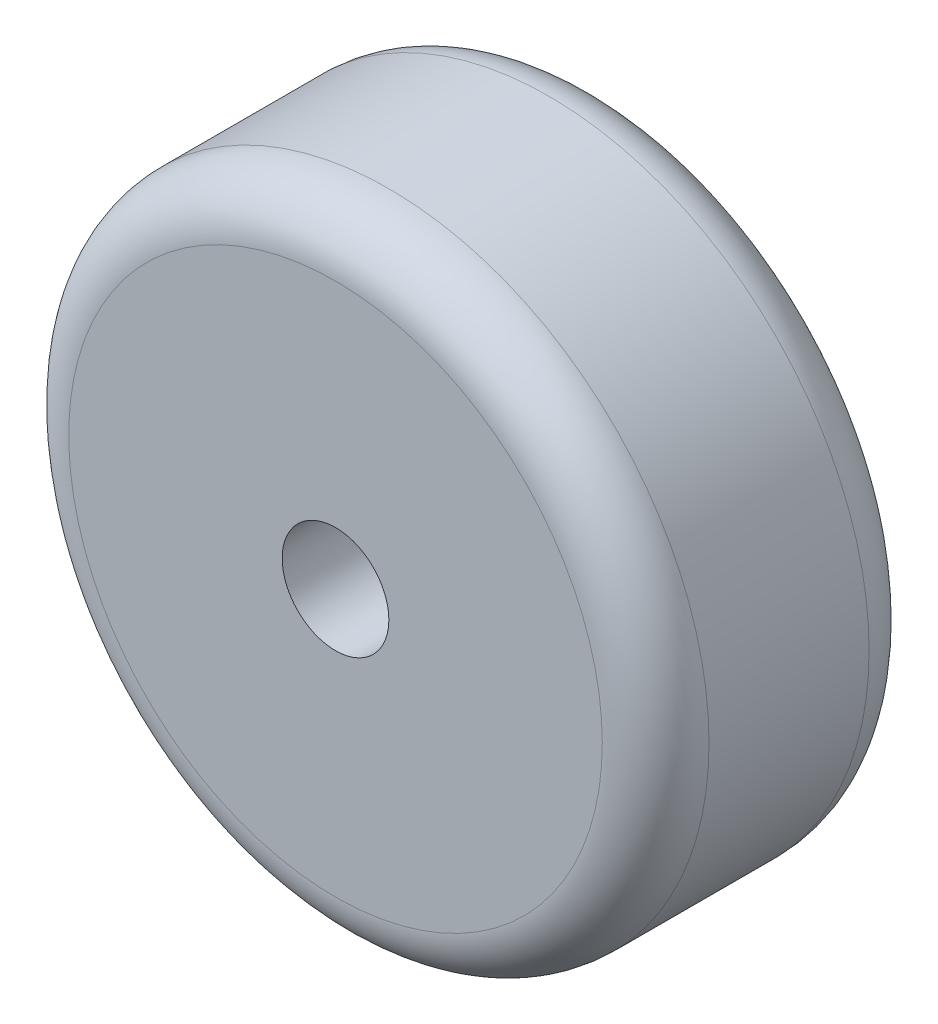
from build123d import *

# Parameters (mm, degrees)
SKETCH1_R           = 6
SKETCH1_R_2         = 1
BOSS_EXTRUDE1_DEPTH = 5
FILLET1_R           = 1


with BuildPart() as part:
    # Sketch1 → Boss-Extrude1 (new body)
    with BuildSketch(Plane.XY):
        with Locations((0, 491.000207075)):
            Circle(SKETCH1_R)
        with Locations((0, 491.000207075)):
            Circle(SKETCH1_R_2, mode=Mode.SUBTRACT)
    extrude(amount=BOSS_EXTRUDE1_DEPTH)

    # Fillet1
    fillet1_edges = [part.edges().sort_by_distance(p)[0] for p in [
        (-6, 491.000207075, 0),
        (-6, 491.000207075, 5),
    ]]
    fillet(fillet1_edges, radius=FILLET1_R)


solid = part.part
